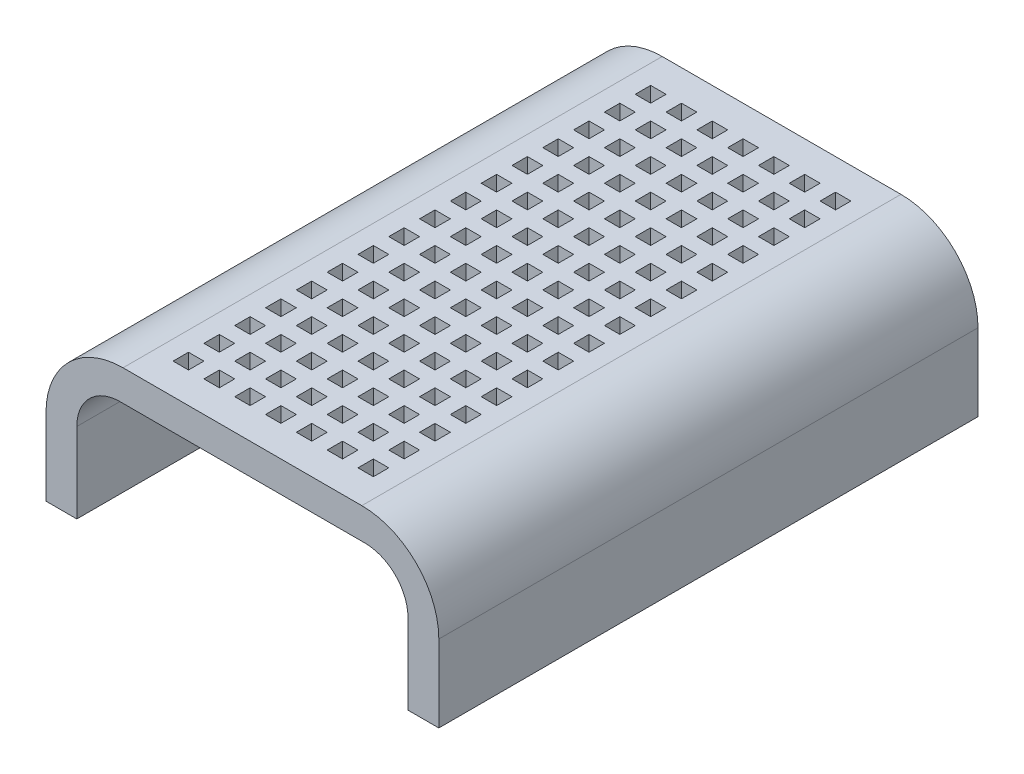
from build123d import *

# Parameters (mm, degrees)
BOSS_EXTRU_2_DEPTH      = 35
ESQUISSE2_W             = 21.5
ESQUISSE2_H             = 8
ENL_V_MAT_EXTRU_1_DEPTH = 35
CONG_1_R                = 2.8
ESQUISSE3_W             = 1
ESQUISSE3_H             = 1
ENL_V_MAT_EXTRU_2_DEPTH = 2


with BuildPart() as part:
    # Esquisse1 → Boss.-Extru.2 (new body)
    with BuildSketch(Plane.XY):
        with BuildLine():
            Line((-6.912408759, 2), (8.587591241, 2))
            ThreePointArc((8.587591241, 2), (12.123125147, 0.535533906), (13.587591241, -3))
            Line((13.587591241, -3), (13.587591241, -8))
            Line((13.587591241, -8), (-11.912408759, -8))
            Line((-11.912408759, -8), (-11.912408759, -3))
            ThreePointArc((-11.912408759, -3), (-10.447942665, 0.535533906), (-6.912408759, 2))
        make_face()
    extrude(amount=-BOSS_EXTRU_2_DEPTH)

    # Esquisse2 → Enlèv. mat.-Extru.1 (cut)
    with BuildSketch(Plane.XY):
        with Locations((0.837591241, -4)):
            Rectangle(ESQUISSE2_W, ESQUISSE2_H)
    extrude(amount=-ENL_V_MAT_EXTRU_1_DEPTH, mode=Mode.SUBTRACT)

    # Congé1
    cong_1_edges = [part.edges().sort_by_distance(p)[0] for p in [
        (11.587591241, 0, -17.5),
        (-9.912408759, 0, -17.5),
    ]]
    fillet(cong_1_edges, radius=CONG_1_R)

    # Esquisse3 → Enlèv. mat.-Extru.2 (cut)
    with BuildSketch(Plane(origin=(0, 2, 0), x_dir=(1, 0, 0), z_dir=(0, 1, 0))):
        with Locations((-5.162408759, 32.5)):
            Rectangle(ESQUISSE3_W, ESQUISSE3_H)
        with Locations((-3.162408759, 32.5)):
            Rectangle(ESQUISSE3_W, ESQUISSE3_H)
        with Locations((-1.162408759, 32.5)):
            Rectangle(ESQUISSE3_W, ESQUISSE3_H)
        with Locations((0.837591241, 32.5)):
            Rectangle(ESQUISSE3_W, ESQUISSE3_H)
        with Locations((2.837591241, 32.5)):
            Rectangle(ESQUISSE3_W, ESQUISSE3_H)
        with Locations((4.837591241, 32.5)):
            Rectangle(ESQUISSE3_W, ESQUISSE3_H)
        with Locations((6.837591241, 32.5)):
            Rectangle(ESQUISSE3_W, ESQUISSE3_H)
        with Locations((-3.162408759, 30.5)):
            Rectangle(ESQUISSE3_W, ESQUISSE3_H)
        with Locations((-1.162408759, 30.5)):
            Rectangle(ESQUISSE3_W, ESQUISSE3_H)
        with Locations((0.837591241, 30.5)):
            Rectangle(ESQUISSE3_W, ESQUISSE3_H)
        with Locations((2.837591241, 30.5)):
            Rectangle(ESQUISSE3_W, ESQUISSE3_H)
        with Locations((4.837591241, 30.5)):
            Rectangle(ESQUISSE3_W, ESQUISSE3_H)
        with Locations((6.837591241, 30.5)):
            Rectangle(ESQUISSE3_W, ESQUISSE3_H)
        with Locations((-3.162408759, 28.5)):
            Rectangle(ESQUISSE3_W, ESQUISSE3_H)
        with Locations((-1.162408759, 28.5)):
            Rectangle(ESQUISSE3_W, ESQUISSE3_H)
        with Locations((0.837591241, 28.5)):
            Rectangle(ESQUISSE3_W, ESQUISSE3_H)
        with Locations((2.837591241, 28.5)):
            Rectangle(ESQUISSE3_W, ESQUISSE3_H)
        with Locations((4.837591241, 28.5)):
            Rectangle(ESQUISSE3_W, ESQUISSE3_H)
        with Locations((6.837591241, 28.5)):
            Rectangle(ESQUISSE3_W, ESQUISSE3_H)
        with Locations((-3.162408759, 26.5)):
            Rectangle(ESQUISSE3_W, ESQUISSE3_H)
        with Locations((-1.162408759, 26.5)):
            Rectangle(ESQUISSE3_W, ESQUISSE3_H)
        with Locations((0.837591241, 26.5)):
            Rectangle(ESQUISSE3_W, ESQUISSE3_H)
        with Locations((2.837591241, 26.5)):
            Rectangle(ESQUISSE3_W, ESQUISSE3_H)
        with Locations((4.837591241, 26.5)):
            Rectangle(ESQUISSE3_W, ESQUISSE3_H)
        with Locations((6.837591241, 26.5)):
            Rectangle(ESQUISSE3_W, ESQUISSE3_H)
        with Locations((-3.162408759, 24.5)):
            Rectangle(ESQUISSE3_W, ESQUISSE3_H)
        with Locations((-1.162408759, 24.5)):
            Rectangle(ESQUISSE3_W, ESQUISSE3_H)
        with Locations((0.837591241, 24.5)):
            Rectangle(ESQUISSE3_W, ESQUISSE3_H)
        with Locations((2.837591241, 24.5)):
            Rectangle(ESQUISSE3_W, ESQUISSE3_H)
        with Locations((4.837591241, 24.5)):
            Rectangle(ESQUISSE3_W, ESQUISSE3_H)
        with Locations((6.837591241, 24.5)):
            Rectangle(ESQUISSE3_W, ESQUISSE3_H)
        with Locations((-3.162408759, 22.5)):
            Rectangle(ESQUISSE3_W, ESQUISSE3_H)
        with Locations((-1.162408759, 22.5)):
            Rectangle(ESQUISSE3_W, ESQUISSE3_H)
        with Locations((0.837591241, 22.5)):
            Rectangle(ESQUISSE3_W, ESQUISSE3_H)
        with Locations((2.837591241, 22.5)):
            Rectangle(ESQUISSE3_W, ESQUISSE3_H)
        with Locations((4.837591241, 22.5)):
            Rectangle(ESQUISSE3_W, ESQUISSE3_H)
        with Locations((6.837591241, 22.5)):
            Rectangle(ESQUISSE3_W, ESQUISSE3_H)
        with Locations((-3.162408759, 20.5)):
            Rectangle(ESQUISSE3_W, ESQUISSE3_H)
        with Locations((-1.162408759, 20.5)):
            Rectangle(ESQUISSE3_W, ESQUISSE3_H)
        with Locations((0.837591241, 20.5)):
            Rectangle(ESQUISSE3_W, ESQUISSE3_H)
        with Locations((2.837591241, 20.5)):
            Rectangle(ESQUISSE3_W, ESQUISSE3_H)
        with Locations((4.837591241, 20.5)):
            Rectangle(ESQUISSE3_W, ESQUISSE3_H)
        with Locations((6.837591241, 20.5)):
            Rectangle(ESQUISSE3_W, ESQUISSE3_H)
        with Locations((-3.162408759, 18.5)):
            Rectangle(ESQUISSE3_W, ESQUISSE3_H)
        with Locations((-1.162408759, 18.5)):
            Rectangle(ESQUISSE3_W, ESQUISSE3_H)
        with Locations((0.837591241, 18.5)):
            Rectangle(ESQUISSE3_W, ESQUISSE3_H)
        with Locations((2.837591241, 18.5)):
            Rectangle(ESQUISSE3_W, ESQUISSE3_H)
        with Locations((4.837591241, 18.5)):
            Rectangle(ESQUISSE3_W, ESQUISSE3_H)
        with Locations((6.837591241, 18.5)):
            Rectangle(ESQUISSE3_W, ESQUISSE3_H)
        with Locations((-3.162408759, 16.5)):
            Rectangle(ESQUISSE3_W, ESQUISSE3_H)
        with Locations((-1.162408759, 16.5)):
            Rectangle(ESQUISSE3_W, ESQUISSE3_H)
        with Locations((0.837591241, 16.5)):
            Rectangle(ESQUISSE3_W, ESQUISSE3_H)
        with Locations((2.837591241, 16.5)):
            Rectangle(ESQUISSE3_W, ESQUISSE3_H)
        with Locations((4.837591241, 16.5)):
            Rectangle(ESQUISSE3_W, ESQUISSE3_H)
        with Locations((6.837591241, 16.5)):
            Rectangle(ESQUISSE3_W, ESQUISSE3_H)
        with Locations((-3.162408759, 14.5)):
            Rectangle(ESQUISSE3_W, ESQUISSE3_H)
        with Locations((-1.162408759, 14.5)):
            Rectangle(ESQUISSE3_W, ESQUISSE3_H)
        with Locations((0.837591241, 14.5)):
            Rectangle(ESQUISSE3_W, ESQUISSE3_H)
        with Locations((2.837591241, 14.5)):
            Rectangle(ESQUISSE3_W, ESQUISSE3_H)
        with Locations((4.837591241, 14.5)):
            Rectangle(ESQUISSE3_W, ESQUISSE3_H)
        with Locations((6.837591241, 14.5)):
            Rectangle(ESQUISSE3_W, ESQUISSE3_H)
        with Locations((-3.162408759, 12.5)):
            Rectangle(ESQUISSE3_W, ESQUISSE3_H)
        with Locations((-1.162408759, 12.5)):
            Rectangle(ESQUISSE3_W, ESQUISSE3_H)
        with Locations((0.837591241, 12.5)):
            Rectangle(ESQUISSE3_W, ESQUISSE3_H)
        with Locations((2.837591241, 12.5)):
            Rectangle(ESQUISSE3_W, ESQUISSE3_H)
        with Locations((4.837591241, 12.5)):
            Rectangle(ESQUISSE3_W, ESQUISSE3_H)
        with Locations((6.837591241, 12.5)):
            Rectangle(ESQUISSE3_W, ESQUISSE3_H)
        with Locations((-3.162408759, 10.5)):
            Rectangle(ESQUISSE3_W, ESQUISSE3_H)
        with Locations((-1.162408759, 10.5)):
            Rectangle(ESQUISSE3_W, ESQUISSE3_H)
        with Locations((0.837591241, 10.5)):
            Rectangle(ESQUISSE3_W, ESQUISSE3_H)
        with Locations((2.837591241, 10.5)):
            Rectangle(ESQUISSE3_W, ESQUISSE3_H)
        with Locations((4.837591241, 10.5)):
            Rectangle(ESQUISSE3_W, ESQUISSE3_H)
        with Locations((6.837591241, 10.5)):
            Rectangle(ESQUISSE3_W, ESQUISSE3_H)
        with Locations((-3.162408759, 8.5)):
            Rectangle(ESQUISSE3_W, ESQUISSE3_H)
        with Locations((-1.162408759, 8.5)):
            Rectangle(ESQUISSE3_W, ESQUISSE3_H)
        with Locations((0.837591241, 8.5)):
            Rectangle(ESQUISSE3_W, ESQUISSE3_H)
        with Locations((2.837591241, 8.5)):
            Rectangle(ESQUISSE3_W, ESQUISSE3_H)
        with Locations((4.837591241, 8.5)):
            Rectangle(ESQUISSE3_W, ESQUISSE3_H)
        with Locations((6.837591241, 8.5)):
            Rectangle(ESQUISSE3_W, ESQUISSE3_H)
        with Locations((-3.162408759, 6.5)):
            Rectangle(ESQUISSE3_W, ESQUISSE3_H)
        with Locations((-1.162408759, 6.5)):
            Rectangle(ESQUISSE3_W, ESQUISSE3_H)
        with Locations((0.837591241, 6.5)):
            Rectangle(ESQUISSE3_W, ESQUISSE3_H)
        with Locations((2.837591241, 6.5)):
            Rectangle(ESQUISSE3_W, ESQUISSE3_H)
        with Locations((4.837591241, 6.5)):
            Rectangle(ESQUISSE3_W, ESQUISSE3_H)
        with Locations((6.837591241, 6.5)):
            Rectangle(ESQUISSE3_W, ESQUISSE3_H)
        with Locations((-3.162408759, 4.5)):
            Rectangle(ESQUISSE3_W, ESQUISSE3_H)
        with Locations((-1.162408759, 4.5)):
            Rectangle(ESQUISSE3_W, ESQUISSE3_H)
        with Locations((0.837591241, 4.5)):
            Rectangle(ESQUISSE3_W, ESQUISSE3_H)
        with Locations((2.837591241, 4.5)):
            Rectangle(ESQUISSE3_W, ESQUISSE3_H)
        with Locations((4.837591241, 4.5)):
            Rectangle(ESQUISSE3_W, ESQUISSE3_H)
        with Locations((6.837591241, 4.5)):
            Rectangle(ESQUISSE3_W, ESQUISSE3_H)
        with Locations((-3.162408759, 2.5)):
            Rectangle(ESQUISSE3_W, ESQUISSE3_H)
        with Locations((-1.162408759, 2.5)):
            Rectangle(ESQUISSE3_W, ESQUISSE3_H)
        with Locations((0.837591241, 2.5)):
            Rectangle(ESQUISSE3_W, ESQUISSE3_H)
        with Locations((2.837591241, 2.5)):
            Rectangle(ESQUISSE3_W, ESQUISSE3_H)
        with Locations((4.837591241, 2.5)):
            Rectangle(ESQUISSE3_W, ESQUISSE3_H)
        with Locations((6.837591241, 2.5)):
            Rectangle(ESQUISSE3_W, ESQUISSE3_H)
        with Locations((-5.162408759, 30.5)):
            Rectangle(ESQUISSE3_W, ESQUISSE3_H)
        with Locations((-5.162408759, 28.5)):
            Rectangle(ESQUISSE3_W, ESQUISSE3_H)
        with Locations((-5.162408759, 26.5)):
            Rectangle(ESQUISSE3_W, ESQUISSE3_H)
        with Locations((-5.162408759, 24.5)):
            Rectangle(ESQUISSE3_W, ESQUISSE3_H)
        with Locations((-5.162408759, 22.5)):
            Rectangle(ESQUISSE3_W, ESQUISSE3_H)
        with Locations((-5.162408759, 20.5)):
            Rectangle(ESQUISSE3_W, ESQUISSE3_H)
        with Locations((-5.162408759, 18.5)):
            Rectangle(ESQUISSE3_W, ESQUISSE3_H)
        with Locations((-5.162408759, 16.5)):
            Rectangle(ESQUISSE3_W, ESQUISSE3_H)
        with Locations((-5.162408759, 14.5)):
            Rectangle(ESQUISSE3_W, ESQUISSE3_H)
        with Locations((-5.162408759, 12.5)):
            Rectangle(ESQUISSE3_W, ESQUISSE3_H)
        with Locations((-5.162408759, 10.5)):
            Rectangle(ESQUISSE3_W, ESQUISSE3_H)
        with Locations((-5.162408759, 8.5)):
            Rectangle(ESQUISSE3_W, ESQUISSE3_H)
        with Locations((-5.162408759, 6.5)):
            Rectangle(ESQUISSE3_W, ESQUISSE3_H)
        with Locations((-5.162408759, 4.5)):
            Rectangle(ESQUISSE3_W, ESQUISSE3_H)
        with Locations((-5.162408759, 2.5)):
            Rectangle(ESQUISSE3_W, ESQUISSE3_H)
    extrude(amount=-ENL_V_MAT_EXTRU_2_DEPTH, mode=Mode.SUBTRACT)


solid = part.part
